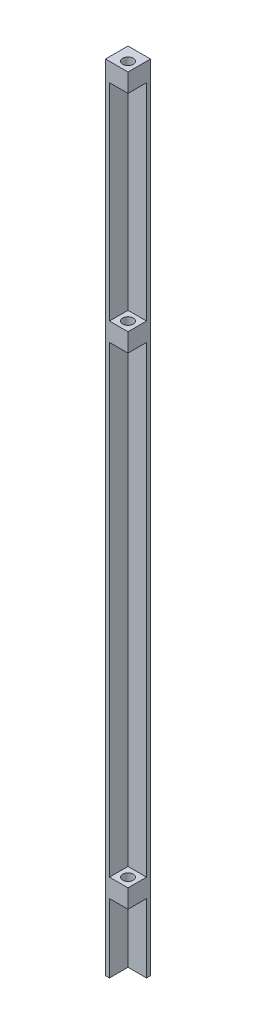
from build123d import *

# Parameters (mm, degrees)
SKETCH1_W           = 8.5
SKETCH1_H           = 8.5
BOSS_EXTRUDE1_DEPTH = 300
SKETCH2_W           = 7
SKETCH2_H           = 7
CUT_EXTRUDE2_DEPTH  = 175
SKETCH4_R           = 2
CUT_EXTRUDE4_DEPTH  = 10
SKETCH6_W           = 7
SKETCH6_H           = 7
CUT_EXTRUDE5_DEPTH  = 26
SKETCH7_R           = 2
CUT_EXTRUDE6_DEPTH  = 26
SKETCH8_W           = 7
SKETCH8_H           = 7
CUT_EXTRUDE7_DEPTH  = 85
BOSS_EXTRUDE2_START = -7
SKETCH9_W           = 7
SKETCH9_H           = 7
SKETCH9_R           = 2
BOSS_EXTRUDE2_DEPTH = 7


with BuildPart() as part:
    # Sketch1 → Boss-Extrude1 (new body)
    with BuildSketch(Plane(origin=(0, 0, 0), x_dir=(1, 0, 0), z_dir=(0, 1, 0))):
        with Locations((4.25, 4.25)):
            Rectangle(SKETCH1_W, SKETCH1_H)
    extrude(amount=BOSS_EXTRUDE1_DEPTH)

    # Sketch2 → Cut-Extrude2 (cut)
    with BuildSketch(Plane(origin=(0, 33, 0), x_dir=(-1, 0, 0), z_dir=(0, -1, 0))):
        with Locations((-5, 3.5)):
            Rectangle(SKETCH2_W, SKETCH2_H)
    extrude(amount=-CUT_EXTRUDE2_DEPTH, mode=Mode.SUBTRACT)

    # Sketch4 → Cut-Extrude4 (cut)
    with BuildSketch(Plane.XZ.offset(-208)):
        with Locations(Location((5, -3.5, 0), (0, 0, 270))):
            Circle(SKETCH4_R)
    extrude(amount=-CUT_EXTRUDE4_DEPTH, mode=Mode.SUBTRACT)

    # Sketch6 → Cut-Extrude5 (cut)
    with BuildSketch(Plane.XZ):
        with Locations((5, -3.5)):
            Rectangle(SKETCH6_W, SKETCH6_H)
    extrude(amount=-CUT_EXTRUDE5_DEPTH, mode=Mode.SUBTRACT)

    # Sketch7 → Cut-Extrude6 (cut)
    with BuildSketch(Plane.XZ.offset(-26)):
        with Locations(Location((5, -3.5, 0), (0, 0, 270))):
            Circle(SKETCH7_R)
    extrude(amount=-CUT_EXTRUDE6_DEPTH, mode=Mode.SUBTRACT)

    # Sketch8 → Cut-Extrude7 (cut)
    with BuildSketch(Plane(origin=(0, 300, 0), x_dir=(1, 0, 0), z_dir=(0, 1, 0))):
        with Locations((5, 3.5)):
            Rectangle(SKETCH8_W, SKETCH8_H)
    extrude(amount=-CUT_EXTRUDE7_DEPTH, mode=Mode.SUBTRACT)

    # Sketch9 → Boss-Extrude2 (add)
    with BuildSketch(Plane(origin=(0, 300, 0), x_dir=(1, 0, 0), z_dir=(0, 1, 0)).offset(BOSS_EXTRUDE2_START)):
        with Locations((5, 3.5)):
            Rectangle(SKETCH9_W, SKETCH9_H)
        with Locations(Location((5, 3.5, 0), (0, 0, 90))):
            Circle(SKETCH9_R, mode=Mode.SUBTRACT)
    extrude(amount=BOSS_EXTRUDE2_DEPTH)


solid = part.part
